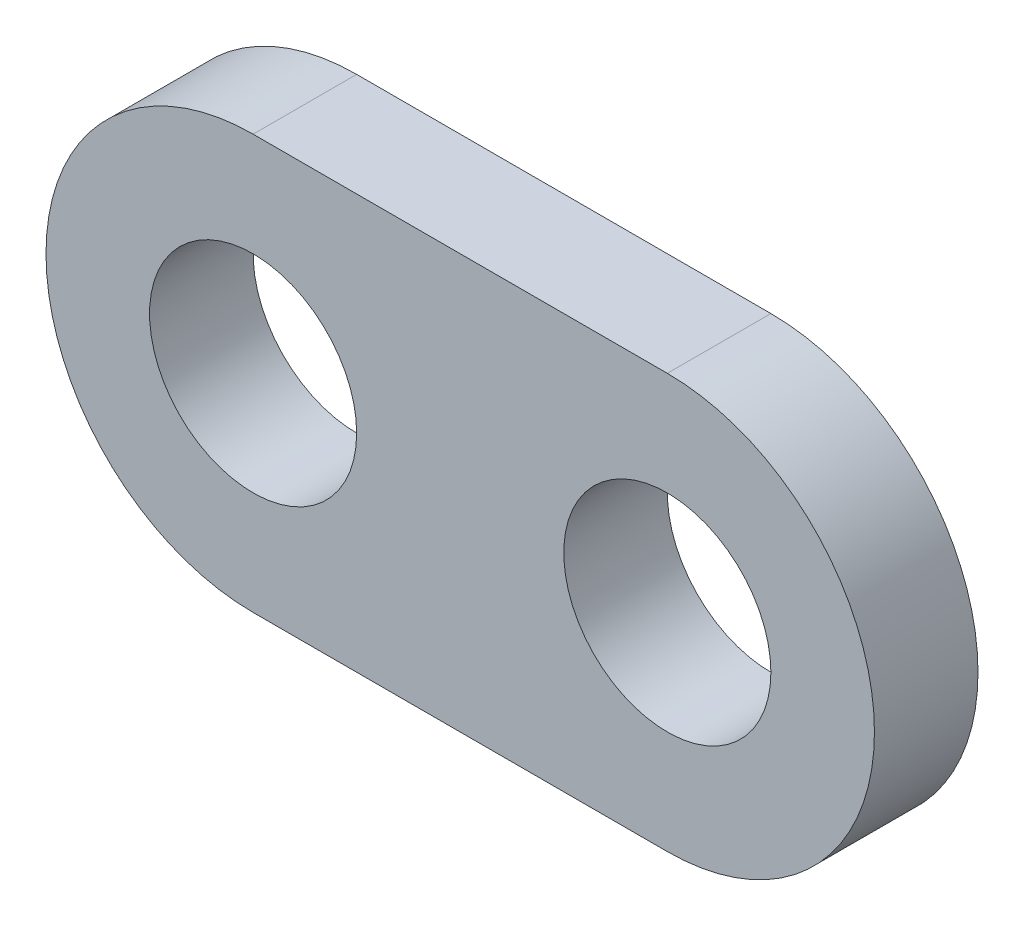
from build123d import *

# Parameters (mm, degrees)
SKETCH1_R           = 5
BOSS_EXTRUDE1_DEPTH = 5


with BuildPart() as part:
    # Sketch1 → Boss-Extrude1 (new body)
    with BuildSketch(Plane.XY):
        with BuildLine():
            Line((0, 10), (20, 10))
            ThreePointArc((20, 10), (30, 0), (20, -10))
            Line((20, -10), (0, -10))
            ThreePointArc((0, -10), (-10, 0), (0, 10))
        make_face()
        Circle(SKETCH1_R, mode=Mode.SUBTRACT)
        with Locations((20, 0)):
            Circle(SKETCH1_R, mode=Mode.SUBTRACT)
    extrude(amount=BOSS_EXTRUDE1_DEPTH)


solid = part.part
